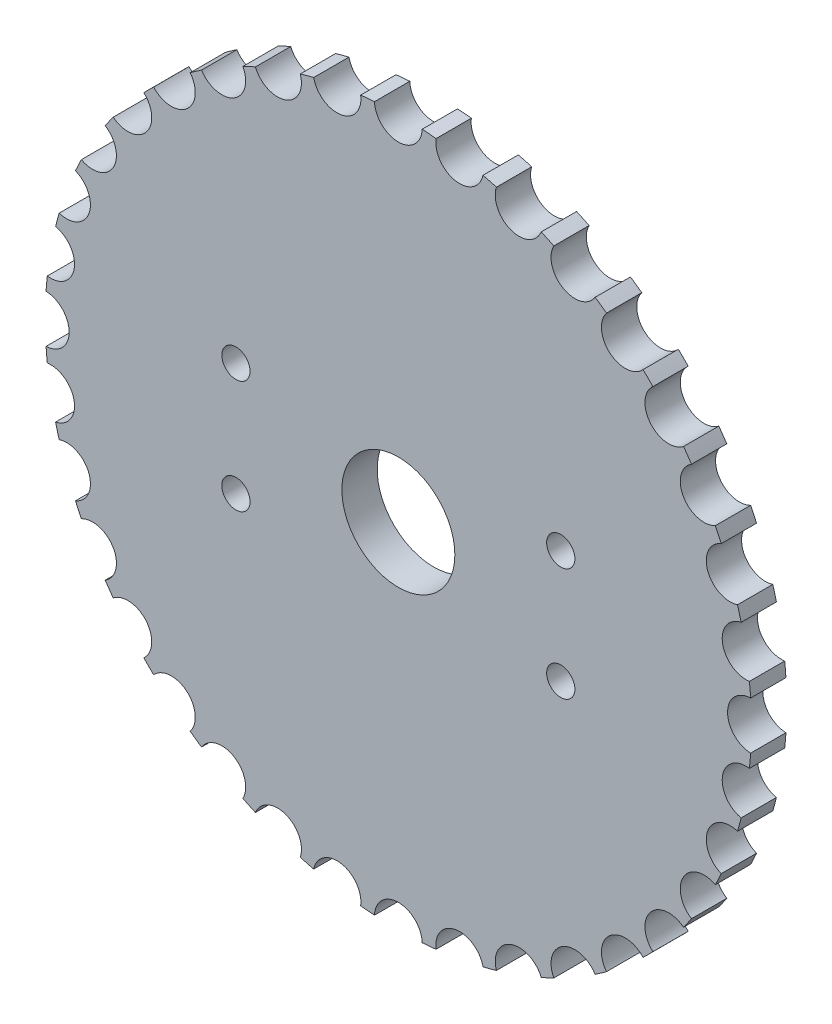
from build123d import *

# Parameters (mm, degrees)
SKETCH_1_R          = 50
EXTRUDE_1_DEPTH     = 5
SKETCH_4_R          = 8
CUT_EXTRUDE_3_DEPTH = 10
SKETCH_5_R          = 2
CUT_EXTRUDE_4_DEPTH = 10
SKETCH_6_R          = 3.38
CUT_EXTRUDE_5_DEPTH = 71.887234394


with BuildPart() as part:
    # 스케치1 → 보스-돌출1 (new body)
    with BuildSketch(Plane.XY):
        Circle(SKETCH_1_R)
    extrude(amount=EXTRUDE_1_DEPTH)

    # 스케치4 → 컷-돌출3 (cut)
    with BuildSketch(Plane.XY.offset(5)):
        Circle(SKETCH_4_R)
    extrude(amount=-CUT_EXTRUDE_3_DEPTH, mode=Mode.SUBTRACT)

    # 스케치5 → 컷-돌출4 (cut)
    with BuildSketch(Plane.XY.offset(5)):
        with Locations((-23, 8)):
            Circle(SKETCH_5_R)
        with Locations((23, 8)):
            Circle(SKETCH_5_R)
        with Locations((23, -8)):
            Circle(SKETCH_5_R)
        with Locations((-23, -8)):
            Circle(SKETCH_5_R)
    extrude(amount=-CUT_EXTRUDE_4_DEPTH, mode=Mode.SUBTRACT)

    # 스케치6 → 컷-돌출5 (cut, through all)
    with BuildSketch(Plane.XY.offset(5)):
        with Locations((0, 50)):
            Circle(SKETCH_6_R)
        with Locations((8.682408883, 49.240387651)):
            Circle(SKETCH_6_R)
        with Locations((17.101007166, 46.984631039)):
            Circle(SKETCH_6_R)
        with Locations((25, 43.301270189)):
            Circle(SKETCH_6_R)
        with Locations((32.139380484, 38.302222156)):
            Circle(SKETCH_6_R)
        with Locations((38.302222156, 32.139380484)):
            Circle(SKETCH_6_R)
        with Locations((43.301270189, 25)):
            Circle(SKETCH_6_R)
        with Locations((46.984631039, 17.101007166)):
            Circle(SKETCH_6_R)
        with Locations((49.240387651, 8.682408883)):
            Circle(SKETCH_6_R)
        with Locations((50, 0)):
            Circle(SKETCH_6_R)
        with Locations((49.240387651, -8.682408883)):
            Circle(SKETCH_6_R)
        with Locations((46.984631039, -17.101007166)):
            Circle(SKETCH_6_R)
        with Locations((43.301270189, -25)):
            Circle(SKETCH_6_R)
        with Locations((38.302222156, -32.139380484)):
            Circle(SKETCH_6_R)
        with Locations((32.139380484, -38.302222156)):
            Circle(SKETCH_6_R)
        with Locations((25, -43.301270189)):
            Circle(SKETCH_6_R)
        with Locations((17.101007166, -46.984631039)):
            Circle(SKETCH_6_R)
        with Locations((8.682408883, -49.240387651)):
            Circle(SKETCH_6_R)
        with Locations((0, -50)):
            Circle(SKETCH_6_R)
        with Locations((-8.682408883, -49.240387651)):
            Circle(SKETCH_6_R)
        with Locations((-17.101007166, -46.984631039)):
            Circle(SKETCH_6_R)
        with Locations((-25, -43.301270189)):
            Circle(SKETCH_6_R)
        with Locations((-32.139380484, -38.302222156)):
            Circle(SKETCH_6_R)
        with Locations((-38.302222156, -32.139380484)):
            Circle(SKETCH_6_R)
        with Locations((-43.301270189, -25)):
            Circle(SKETCH_6_R)
        with Locations((-46.984631039, -17.101007166)):
            Circle(SKETCH_6_R)
        with Locations((-49.240387651, -8.682408883)):
            Circle(SKETCH_6_R)
        with Locations((-50, 0)):
            Circle(SKETCH_6_R)
        with Locations((-49.240387651, 8.682408883)):
            Circle(SKETCH_6_R)
        with Locations((-46.984631039, 17.101007166)):
            Circle(SKETCH_6_R)
        with Locations((-43.301270189, 25)):
            Circle(SKETCH_6_R)
        with Locations((-38.302222156, 32.139380484)):
            Circle(SKETCH_6_R)
        with Locations((-32.139380484, 38.302222156)):
            Circle(SKETCH_6_R)
        with Locations((-25, 43.301270189)):
            Circle(SKETCH_6_R)
        with Locations((-17.101007166, 46.984631039)):
            Circle(SKETCH_6_R)
        with Locations((-8.682408883, 49.240387651)):
            Circle(SKETCH_6_R)
    extrude(amount=-CUT_EXTRUDE_5_DEPTH, mode=Mode.SUBTRACT)


solid = part.part
